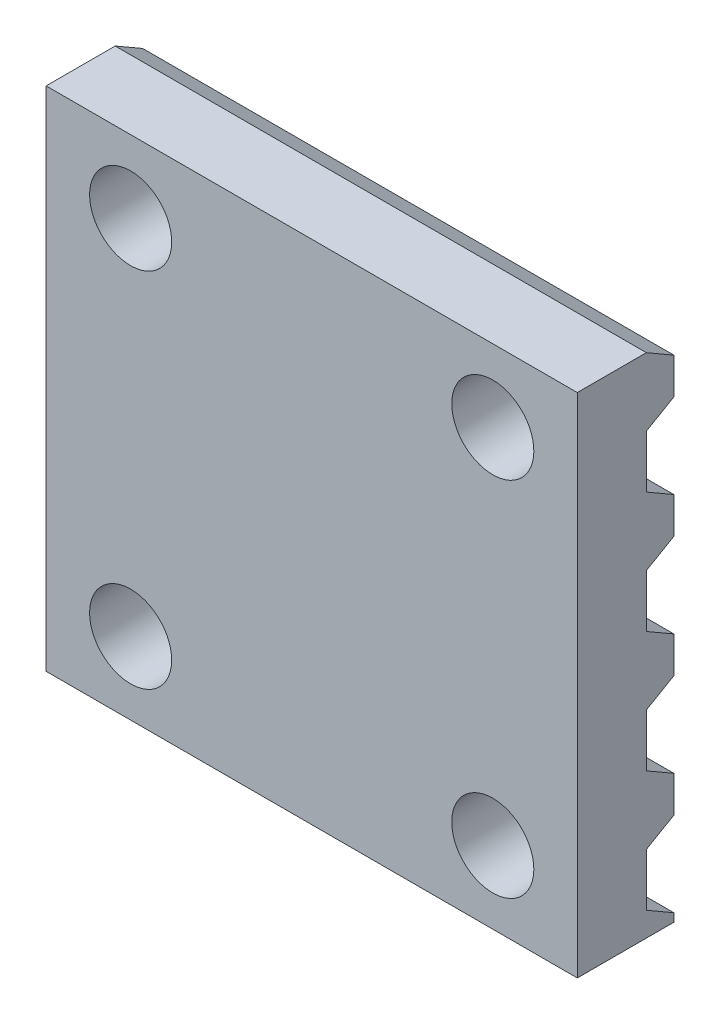
from build123d import *

# Parameters (mm, degrees)
SKETCH_1_W               = 22
SKETCH_1_H               = 21
EXTRUDE_1_DEPTH          = 2.86
EXTRUDE_2_DEPTH          = 22
CUT_EXTRUDE_1_DEPTH      = 16.724185194
CUT_EXTRUDE_1_DEPTH_BACK = 16.724185194
SKETCH_3_R               = 1.7


with BuildPart() as part:
    # 草图1 → 凸台-拉伸1 (new body)
    with BuildSketch(Plane.XY):
        Rectangle(SKETCH_1_W, SKETCH_1_H)
    extrude(amount=EXTRUDE_1_DEPTH)

    # 草图2 → 凸台-拉伸2 (add)
    with BuildSketch(Plane(origin=(11, 0, 0), x_dir=(0, 0, -1), z_dir=(1, 0, 0))):
        Polygon((1.14, -10.158179307), (0, -9.5), (0, -10.5), (1.14, -10.5), align=None)
        Polygon((1.14, -5.158179307), (0, -4.5), (0, -7.316358614), (1.14, -6.658179307), align=None)
        Polygon((1.14, -0.158179307), (0, 0.5), (0, -2.316358614), (1.14, -1.658179307), align=None)
        Polygon((1.14, 4.841820693), (0, 5.5), (0, 2.683641386), (1.14, 3.341820693), align=None)
        Polygon((1.14, 9.841820693), (0, 10.5), (0, 7.683641386), (1.14, 8.341820693), align=None)
    extrude(amount=-EXTRUDE_2_DEPTH)

    # 草图3 → 切除-拉伸1 (cut, two sides: drawn at the far end of the back side and taken through both)
    with BuildSketch(Plane.XY.offset(2.86).offset(-CUT_EXTRUDE_1_DEPTH_BACK)):
        with Locations(Location((7.5, 7.5, 0), (0, 0, 6.201440198))):
            Circle(SKETCH_3_R)
        with Locations(Location((7.5, -7.5, 0), (0, 0, 6.201440198))):
            Circle(SKETCH_3_R)
        with Locations(Location((-7.5, -7.5, 0), (0, 0, 6.201440198))):
            Circle(SKETCH_3_R)
        with Locations(Location((-7.5, 7.5, 0), (0, 0, 6.201440198))):
            Circle(SKETCH_3_R)
    extrude(amount=CUT_EXTRUDE_1_DEPTH + CUT_EXTRUDE_1_DEPTH_BACK, mode=Mode.SUBTRACT)


solid = part.part
